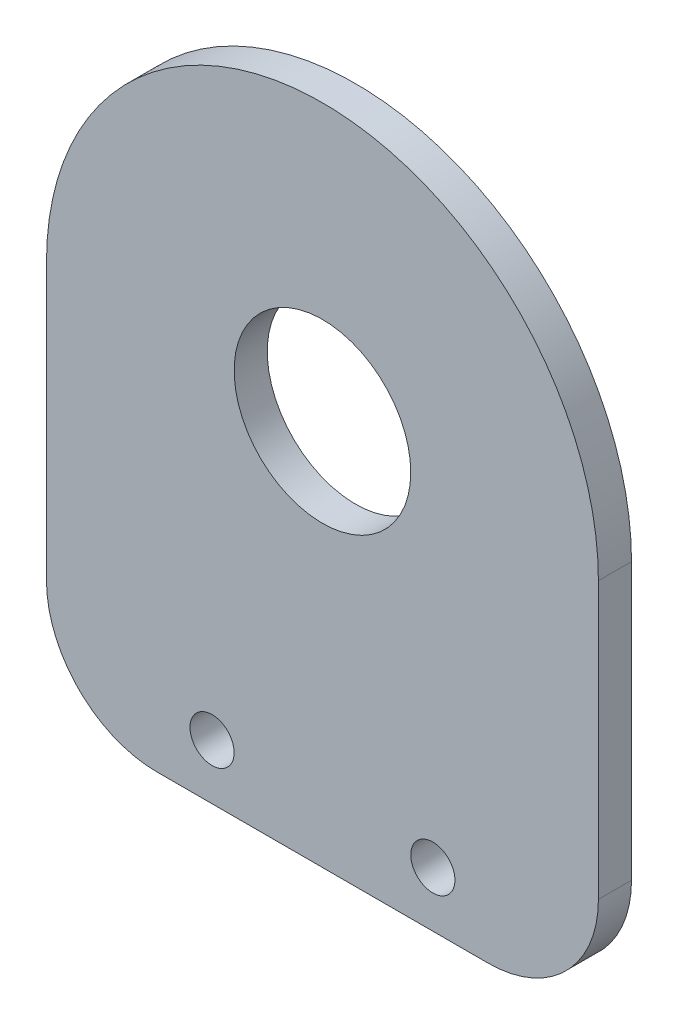
from build123d import *

# Parameters (mm, degrees)
SKETCH_1_R      = 8
SKETCH_1_R_2    = 2
EXTRUDE_1_DEPTH = 3
FILLET_1_R      = 10


with BuildPart() as part:
    # ｽｹｯﾁ1 → ﾎﾞｽ - 押し出し1 (new body)
    with BuildSketch(Plane.XY):
        with BuildLine():
            Line((25, -17.5), (-25, -17.5))
            Line((-25, -17.5), (-25, 17.5))
            ThreePointArc((-25, 17.5), (0, 42.5), (25, 17.5))
            Line((25, 17.5), (25, -17.5))
        make_face()
        with Locations((0, 17.5)):
            Circle(SKETCH_1_R, mode=Mode.SUBTRACT)
        with Locations((-10, -12.5)):
            Circle(SKETCH_1_R_2, mode=Mode.SUBTRACT)
        with Locations((10, -12.5)):
            Circle(SKETCH_1_R_2, mode=Mode.SUBTRACT)
    extrude(amount=EXTRUDE_1_DEPTH)

    # ﾌｨﾚｯﾄ1
    fillet_1_edges = [part.edges().sort_by_distance(p)[0] for p in [
        (25, -17.5, 1.5),
        (-25, -17.5, 1.5),
    ]]
    fillet(fillet_1_edges, radius=FILLET_1_R)


solid = part.part
